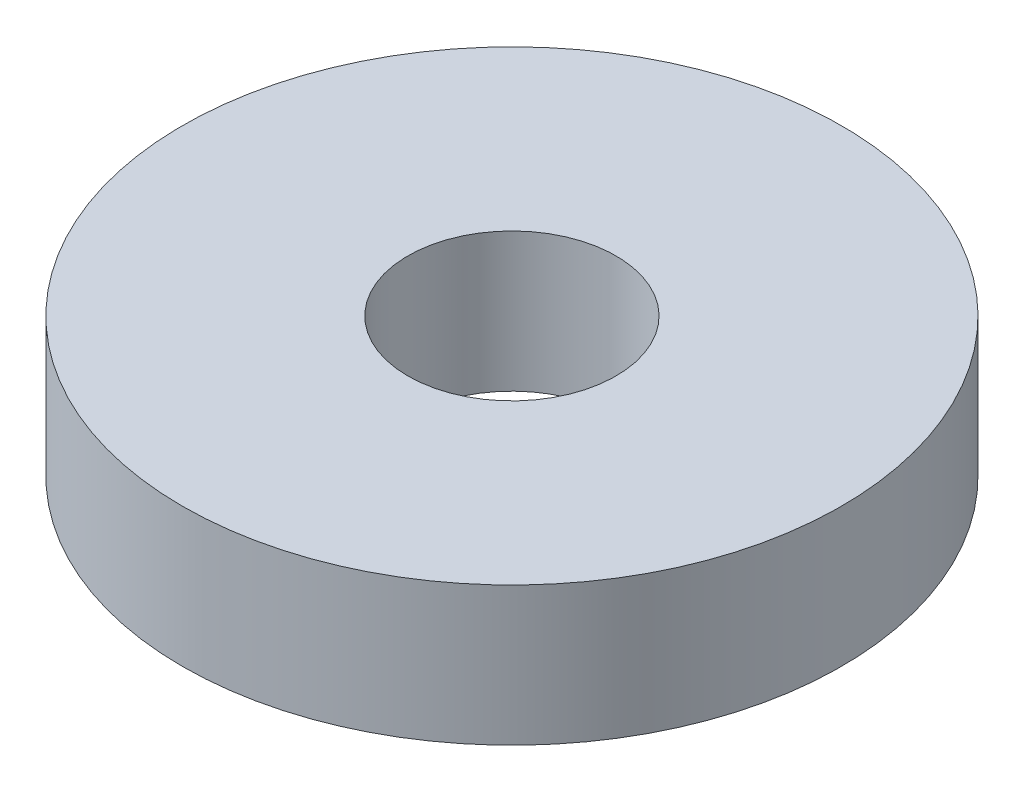
from build123d import *

# Parameters (mm, degrees)
SKETCH_1_R      = 9.5
SKETCH_1_R_2    = 3
EXTRUDE_1_DEPTH = 4


with BuildPart() as part:
    # 草图1 → 凸台-拉伸1 (new body)
    with BuildSketch(Plane(origin=(0, 0, 0), x_dir=(1, 0, 0), z_dir=(0, 1, 0))):
        with Locations(Location((0, 0, 0), (0, 0, 270))):
            Circle(SKETCH_1_R)
        with Locations(Location((0, 0, 0), (0, 0, 270))):
            Circle(SKETCH_1_R_2, mode=Mode.SUBTRACT)
    extrude(amount=EXTRUDE_1_DEPTH)


solid = part.part
